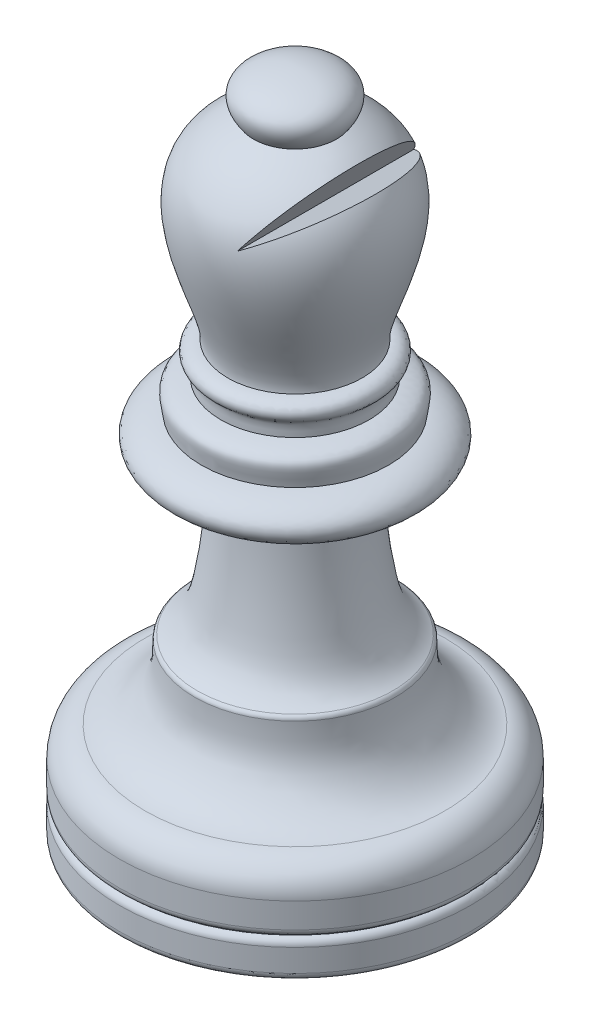
from build123d import *

# Parameters (mm, degrees)
CUT_EXTRUDE1_DEPTH      = 73.190506475
CUT_EXTRUDE1_DEPTH_BACK = 73.190506475


with BuildPart() as part:
    # Sketch2 → Revolve2 (revolve)
    with BuildSketch(Plane.XY, mode=Mode.PRIVATE) as revolve2_sk:
        with BuildLine():
            Line((0, 0), (0, 10.034926072))
            Line((0, 10.034926072), (-15.174290575, 10.034926072))
            ThreePointArc((-15.174290575, 10.034926072), (-17.033998604, 9.069882685), (-17.78, 7.112))
            Line((-17.78, 7.112), (-17.78, 4.572))
            ThreePointArc((-17.78, 4.572), (-17.640170395, 4.132059095), (-17.272, 3.85357951))
            Line((-17.272, 3.85357951), (-17.272, 3.76642049))
            ThreePointArc((-17.272, 3.76642049), (-17.640170395, 3.487940905), (-17.78, 3.048))
            Line((-17.78, 3.048), (-17.78, 0.762))
            ThreePointArc((-17.78, 0.762), (-17.556815367, 0.223184633), (-17.018, 0))
            Line((-17.018, 0), (0, 0))
        make_face()
    revolve(revolve2_sk.sketch.rotate(Axis((0, 0, 0), (0, 1, 0)), 270), axis=Axis((0, 0, 0), (0, 1, 0)))

    # Sketch3 → Revolve3 (revolve)
    with BuildSketch(Plane.XY, mode=Mode.PRIVATE) as revolve3_sk:
        with BuildLine():
            Line((0, 67.669878118), (0, 10.034926072))
            Line((0, 10.034926072), (-15.174290575, 10.034926072))
            add(Edge.make_bspline(
                [(-15.174290575, 10.034926072), (-13.316088216, 10.248866631), (-10.359272765, 13.090170459), (-10.18096728, 15.594899433), (-10.165807206, 17.5050188)],
                knots=[0, 0, 0, 0, 0.538934096, 0.976644515, 0.976644515, 0.976644515, 0.976644515], degree=3))
            ThreePointArc((-10.165807206, 17.5050188), (-10.095912608, 17.758167315), (-9.908935525, 17.942582596))
            add(Edge.make_bspline(
                [(-9.908935525, 17.942582596), (-8.187236187, 18.921623132), (-7.201706327, 22.008467929), (-6.335610939, 28.938463725), (-6.335610939, 32.849530873)],
                knots=[0.034063656, 0.034063656, 0.034063656, 0.034063656, 0.517031828, 1, 1, 1, 1], degree=3))
            add(Edge.make_bspline(
                [(-6.335610939, 32.849530873), (-14.700513533, 33.353836882), (-13.551571537, 37.108265961), (-9.476799879, 37.509544193)],
                knots=[0, 0, 0, 0, 1, 1, 1, 1], degree=3))
            add(Edge.make_bspline(
                [(-9.476799879, 37.509544193), (-9.658863157, 39.311181821), (-10.409099173, 40.126101453), (-7.502563524, 40.495892352)],
                knots=[0, 0, 0, 0, 1, 1, 1, 1], degree=3))
            add(Edge.make_bspline(
                [(-7.502563524, 40.495892352), (-7.502563524, 41.248999655), (-7.45016532, 41.873203309), (-8.578151677, 42.572298348), (-8.342924586, 43.822278914), (-6.803987129, 43.822278914)],
                knots=[0, 0, 0, 0, 0.324588278, 0.424588278, 1, 1, 1, 1], degree=3))
            add(Edge.make_bspline(
                [(-6.803987129, 43.822278914), (-6.28085601, 47.521336167), (-14.907557534, 58.928647782), (-4.201855879, 63.464815017)],
                knots=[0, 0, 0, 0, 1, 1, 1, 1], degree=3))
            add(Edge.make_bspline(
                [(-4.201855879, 63.464815017), (-6.784046287, 66.883878184), (-1.893847981, 67.669878118), (0, 67.669878118)],
                knots=[0, 0, 0, 0, 1, 1, 1, 1], degree=3))
        make_face()
    revolve(revolve3_sk.sketch.rotate(Axis((0, 67.669878118, 0), (0, -1, 0)), 270), axis=Axis((0, 67.669878118, 0), (0, -1, 0)))

    # Sketch4 → Cut-Extrude1 (cut, two sides: drawn at the far end of the back side and taken through both)
    with BuildSketch(Plane.XY.offset(-CUT_EXTRUDE1_DEPTH_BACK)):
        Polygon((12.319331847, 71.145911235), (3.095994118, 57.557329695), (16.966204291, 65.935781525), align=None)
    extrude(amount=CUT_EXTRUDE1_DEPTH + CUT_EXTRUDE1_DEPTH_BACK, mode=Mode.SUBTRACT)


solid = part.part
